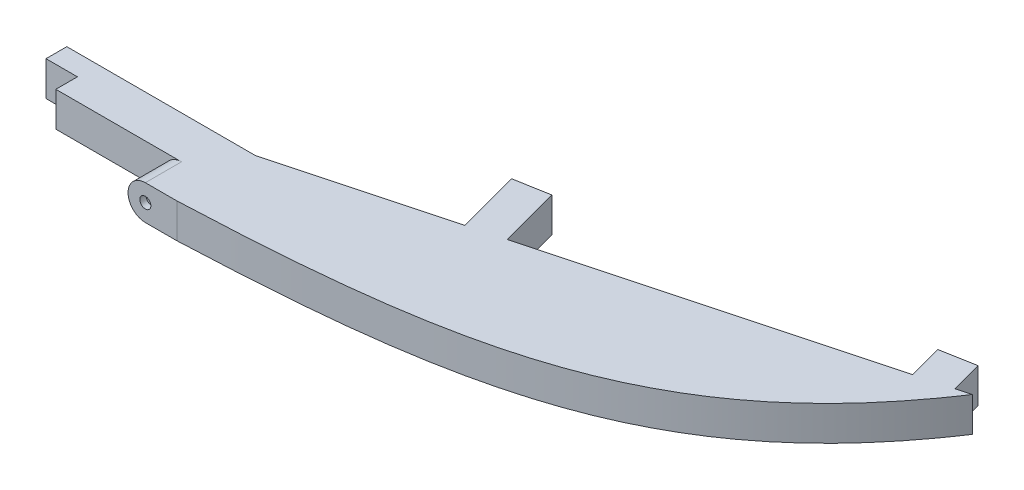
from build123d import *

# Parameters (mm, degrees)
SALIENTE_EXTRUIR1_DEPTH = 5.5
CROQUIS3_W              = 12.5
CROQUIS3_H              = 5.5
SALIENTE_EXTRUIR2_DEPTH = 25
CROQUIS6_R              = 0.88
CORTAR_EXTRUIR3_DEPTH   = 1
CORTAR_EXTRUIR4_DEPTH   = 5.75
CROQUIS7_W              = 3.3125
CROQUIS7_H              = 5.5
SALIENTE_EXTRUIR3_DEPTH = 5
SALIENTE_EXTRUIR6_DEPTH = 5.5


with BuildPart() as part:
    # Croquis2 → Saliente-Extruir1 (new body)
    with BuildSketch(Plane(origin=(0, 0, 0), x_dir=(1, 0, 0), z_dir=(0, 1, 0))):
        with BuildLine():
            Line((0, 0), (0, 12.5))
            Line((0, 12.5), (90, 36.615427319))
            add(Edge.make_bspline(
                [(0, 0), (0.391394635, 0.015775005), (1.186974035, 0.048775969), (2.973718865, 0.125104104), (4.540088904, 0.200260299), (6.566615662, 0.300718996), (8.325276336, 0.397659311), (10.239345298, 0.508699867), (12.06569896, 0.624646025), (14.401457649, 0.783062706), (17.174575564, 0.991527453), (20.424315772, 1.267095632), (24.124041131, 1.631890725), (28.746499447, 2.160588299), (34.186717026, 2.916408992), (39.59920567, 3.869463595), (44.959442778, 5.077074293), (49.361815827, 6.280418231), (52.910692092, 7.400878923), (56.408168852, 8.673928793), (59.841449897, 10.111450972), (63.196917977, 11.722972852), (66.459987179, 13.514457641), (69.616669404, 15.487724177), (72.654216734, 17.639793831), (75.562633469, 19.963554552), (78.411401775, 22.516402339), (80.637238299, 24.750127709), (82.31420302, 26.576865179), (83.500174761, 27.941909388), (84.166451521, 28.729544399), (84.824720597, 29.529498585), (85.467901785, 30.330572576), (86.10961807, 31.152932899), (86.725824802, 31.959637263), (87.359215775, 32.814913902), (87.935303716, 33.605334305), (88.585351463, 34.5293994), (89.07725637, 35.234721433), (89.639386065, 36.072003958), (89.880241627, 36.43386466), (90, 36.615427319)],
                knots=[0.074542826, 0.074542826, 0.074542826, 0.074542826, 0.074542826, 0.089942005, 0.105341185, 0.120740364, 0.136139543, 0.151538723, 0.166937902, 0.182337082, 0.197736262, 0.22853462, 0.259332978, 0.290131335, 0.320929692, 0.382526405, 0.441205382, 0.472003704, 0.502802054, 0.533600416, 0.564398766, 0.595197066, 0.625995423, 0.656793872, 0.687592091, 0.718390433, 0.749188737, 0.779987363, 0.814189109, 0.822739652, 0.831290195, 0.839840738, 0.848391281, 0.856941796, 0.865492311, 0.874042825, 0.88259334, 0.891143874, 0.899694409, 0.908244943, 0.916795477, 0.916795477, 0.916795477, 0.916795477, 0.916795477], degree=4))
        make_face()
    extrude(amount=SALIENTE_EXTRUIR1_DEPTH)

    # Croquis3 → Saliente-Extruir2 (add)
    with BuildSketch(Plane.ZY):
        with Locations((-6.25, 2.75)):
            Rectangle(CROQUIS3_W, CROQUIS3_H)
    extrude(amount=SALIENTE_EXTRUIR2_DEPTH)

    # Croquis6 → Cortar-Extruir3 (cut)
    with BuildSketch(Plane.XY):
        with Locations((-5, 2.75)):
            Circle(CROQUIS6_R)
    extrude(amount=-CORTAR_EXTRUIR3_DEPTH, mode=Mode.SUBTRACT)

    # Croquis5 → Cortar-Extruir4 (cut)
    with BuildSketch(Plane.XY):
        with BuildLine():
            Line((-25, 5.5), (-25, 0))
            Line((-25, 0), (-5.000000004, 0))
            ThreePointArc((-5.000000004, 0), (-7.75, 2.750000002), (-5, 5.5))
            Line((-5, 5.5), (-25, 5.5))
        make_face()
    extrude(amount=-CORTAR_EXTRUIR4_DEPTH, mode=Mode.SUBTRACT)

    # Croquis7 → Saliente-Extruir3 (add)
    with BuildSketch(Plane.ZY.offset(25)):
        with Locations((-10.84375, 2.75)):
            Rectangle(CROQUIS7_W, CROQUIS7_H)
    extrude(amount=SALIENTE_EXTRUIR3_DEPTH)

    # Croquis10 → Saliente-Extruir6 (add)
    with BuildSketch(Plane(origin=(0, 5.5, 0), x_dir=(1, 0, 0), z_dir=(0, 1, 0))):
        Polygon((23.606721454, 29.684431199), (26.321478766, 19.552818979), (31.634070811, 20.976323727), (29.03783695, 30.665600406), align=None)
        Polygon((81.052969303, 40.062499841), (82.514074846, 34.60957972), (87.826666891, 36.033084468), (86.484084799, 41.043669048), align=None)
    extrude(amount=-SALIENTE_EXTRUIR6_DEPTH)


solid = part.part
